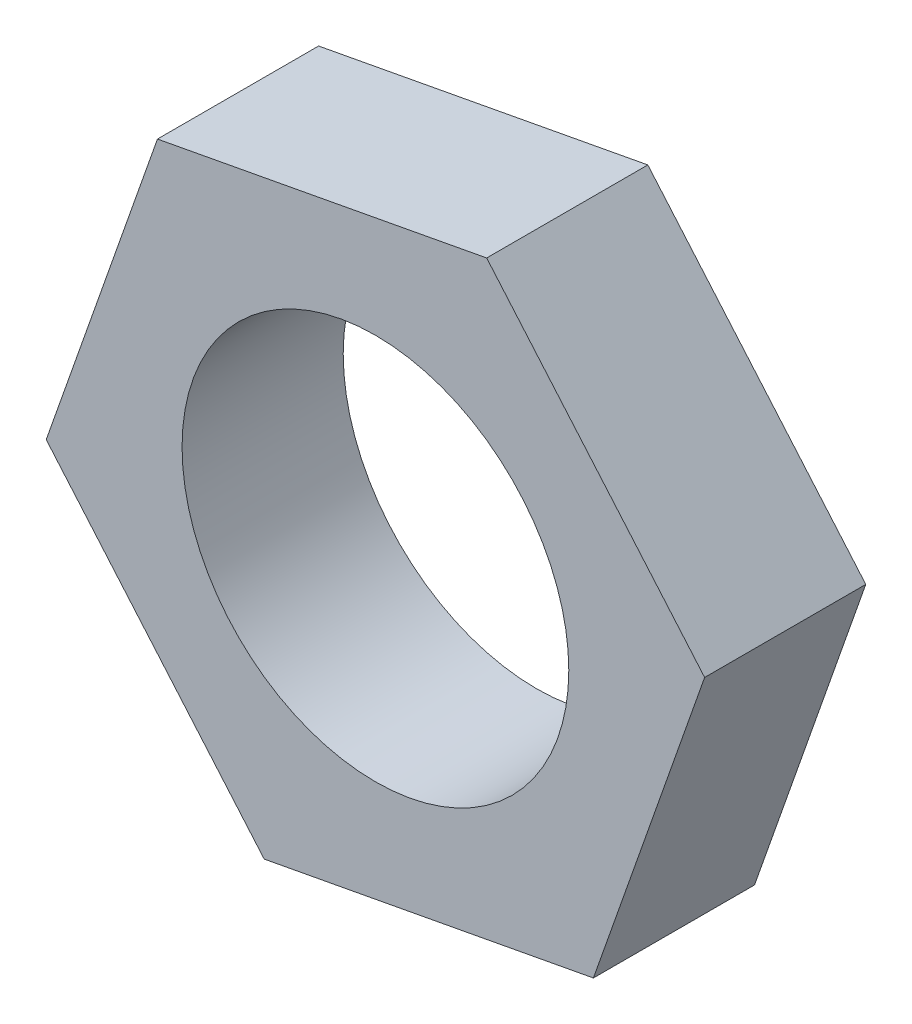
from build123d import *

# Parameters (mm, degrees)
SKETCH1_R           = 6
BOSS_EXTRUDE1_DEPTH = 2.5


with BuildPart() as part:
    # Sketch1 → Boss-Extrude1 (new, symmetric)
    with BuildSketch(Plane.XY):
        Polygon((6.763222344, -7.890426068), (10.214920593, 1.911909327), (3.451698249, 9.802335395), (-6.763222344, 7.890426068), (-10.214920593, -1.911909327), (-3.451698249, -9.802335395), align=None)
        Circle(SKETCH1_R, mode=Mode.SUBTRACT)
    extrude(amount=BOSS_EXTRUDE1_DEPTH, both=True)


solid = part.part
